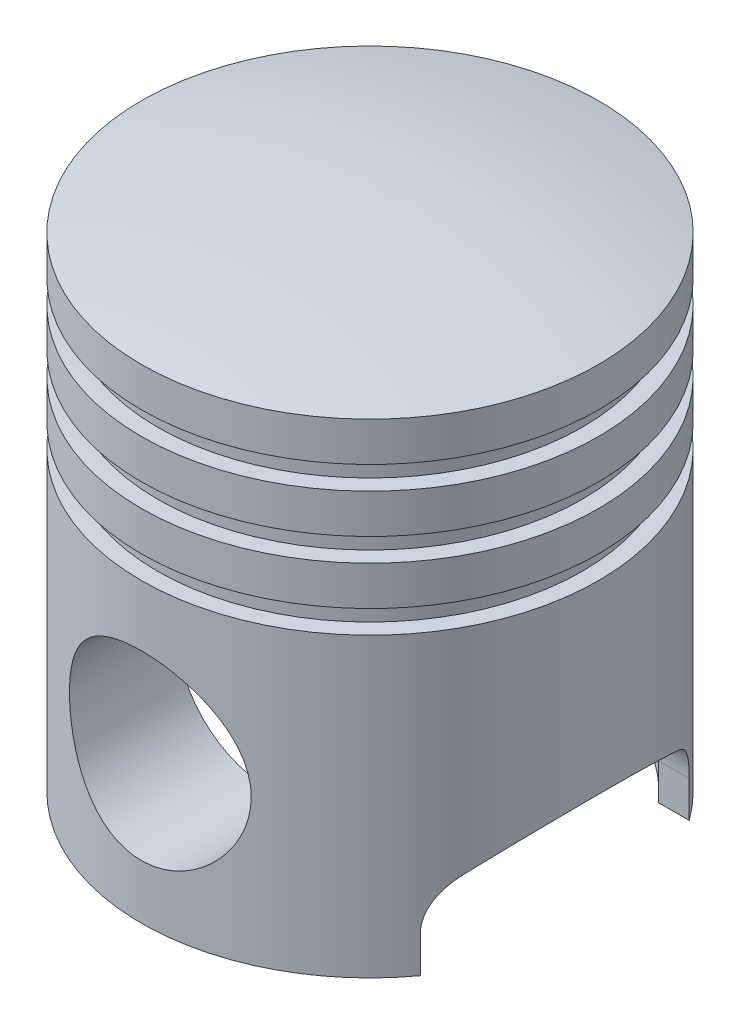
from build123d import *

# Parameters (mm, degrees)
SKETCH6_R                = 1079.5
BOSS_EXTRUDE3_DEPTH      = 2286
CUT_EXTRUDE6_START       = -185.42
SKETCH7_OUTSIDE_W        = 2923.846
SKETCH7_OUTSIDE_H        = 2923.846
SKETCH7_OUTSIDE_R        = 1003.3
CUT_EXTRUDE6_DEPTH       = 109.22
LPATTERN1_COUNT          = 3
LPATTERN1_PITCH          = 294.64
SKETCH8_R                = 965.2
CUT_EXTRUDE7_DEPTH       = 2159
DOME1_FACE_RADIUS        = 1079.5
DOME1_HEIGHT             = 127
CUT_EXTRUDE9_DEPTH       = 2856.382548801
CUT_EXTRUDE9_DEPTH_BACK  = 2856.382548801
SKETCH9_R                = 429.26
CUT_EXTRUDE10_DEPTH      = 2856.382548877
CUT_EXTRUDE10_DEPTH_BACK = 2856.382548877
FILLET1_R                = 254
BOSS_EXTRUDE8_REACH      = 3339.983
BOSS_EXTRUDE8_END_RADIUS = 965.2
BOSS_EXTRUDE8_START      = 482.6
SKETCH21_R               = 571.5
SKETCH21_R_2             = 429.26


with BuildPart() as part:
    # Sketch6 → Boss-Extrude3 (new body)
    with BuildSketch(Plane(origin=(0, 0, 0), x_dir=(1, 0, 0), z_dir=(0, 1, 0))):
        with Locations(Location((0, 0, 0), (0, 0, 270))):
            Circle(SKETCH6_R)
    extrude(amount=BOSS_EXTRUDE3_DEPTH)

    # Sketch7 outside → Cut-Extrude6 (cut)
    with BuildSketch(Plane(origin=(0, 2286, 0), x_dir=(1, 0, 0), z_dir=(0, 1, 0)).offset(CUT_EXTRUDE6_START)):
        Rectangle(SKETCH7_OUTSIDE_W, SKETCH7_OUTSIDE_H)
        with Locations(Location((0, 0, 0), (0, 0, 270))):
            Circle(SKETCH7_OUTSIDE_R, mode=Mode.SUBTRACT)
    cut_extrude6 = extrude(amount=-CUT_EXTRUDE6_DEPTH, mode=Mode.SUBTRACT)

    # LPattern1: Cut-Extrude6 ×3
    with Locations(*[(0, -i * LPATTERN1_PITCH, 0) for i in range(1, LPATTERN1_COUNT)]):
        add(cut_extrude6, mode=Mode.SUBTRACT)

    # Sketch8 → Cut-Extrude7 (cut)
    with BuildSketch(Plane.XZ):
        with Locations(Location((0, 0, 0), (0, 0, 270))):
            Circle(SKETCH8_R)
    extrude(amount=-CUT_EXTRUDE7_DEPTH, mode=Mode.SUBTRACT)

    # Dome1: a dome of height H over a round flat face of radius A is a cap of a sphere of radius (A * A + H * H) / (2 * H)
    dome1_r = (DOME1_FACE_RADIUS * DOME1_FACE_RADIUS + DOME1_HEIGHT * DOME1_HEIGHT) / (2 * DOME1_HEIGHT)
    dome1_base = Plane((0, 2286, 0), z_dir=(0, 1, 0))
    with Locations(dome1_base.offset(DOME1_HEIGHT - dome1_r)):
        dome1_ball = Sphere(dome1_r, mode=Mode.PRIVATE)
    add(split(dome1_ball, bisect_by=dome1_base, keep=Keep.TOP, mode=Mode.PRIVATE))

    # Sketch9 → Cut-Extrude9 (cut, two sides: drawn at the far end of the back side and taken through both)
    with BuildSketch(Plane.XY.offset(-CUT_EXTRUDE9_DEPTH_BACK)):
        with Locations((0, 685.8)):
            Circle(SKETCH9_R)
    extrude(amount=CUT_EXTRUDE9_DEPTH + CUT_EXTRUDE9_DEPTH_BACK, mode=Mode.SUBTRACT)

    # Sketch18 → Cut-Extrude10 (cut, two sides: drawn at the far end of the back side and taken through both)
    with BuildSketch(Plane(origin=(0, 0, 0), x_dir=(0, 0, -1), z_dir=(1, 0, 0)).offset(-CUT_EXTRUDE10_DEPTH_BACK)):
        with BuildLine():
            Line((-635, 0), (-635, 304.8))
            ThreePointArc((-635, 304.8), (0, 527.685254203), (635, 304.8))
            Line((635, 304.8), (635, 0))
            Line((635, 0), (-635, 0))
        make_face()
    extrude(amount=CUT_EXTRUDE10_DEPTH + CUT_EXTRUDE10_DEPTH_BACK, mode=Mode.SUBTRACT)

    # Fillet1
    fillet1_edges = [part.edges().sort_by_distance(p)[0] for p in [
        (799.941170684, 304.8, -635),
        (-799.941170684, 304.8, -635),
        (-799.941170684, 304.8, 635),
        (799.941170684, 304.8, 635),
    ]]
    fillet(fillet1_edges, radius=FILLET1_R)

    # Boss-Extrude8: up to this cylinder (the profile starts inside it)
    boss_extrude8_end = Plane(origin=(0, 685.8, 0), z_dir=(0, -1, 0)) * Cylinder(BOSS_EXTRUDE8_END_RADIUS, 8611.366, mode=Mode.PRIVATE)
    # Sketch21 → Boss-Extrude8 (add, up to the surface)
    with BuildSketch(Plane.XY.offset(BOSS_EXTRUDE8_START), mode=Mode.PRIVATE) as boss_extrude8_sk1:
        with Locations(Location((0, 685.8, 0), (0, 0, 180))):
            Circle(SKETCH21_R)
        with Locations((0, 685.8)):
            Circle(SKETCH21_R_2, mode=Mode.SUBTRACT)
    boss_extrude8_tool1 = extrude(boss_extrude8_sk1.sketch, amount=BOSS_EXTRUDE8_REACH, mode=Mode.PRIVATE) & boss_extrude8_end
    boss_extrude8 = boss_extrude8_tool1.solids().sort_by_distance((555.335539, 685.8, 482.6))[0]
    add(boss_extrude8)

    # Mirror1: Boss-Extrude8 across plane
    add(boss_extrude8.mirror(Plane.XY))


solid = part.part
